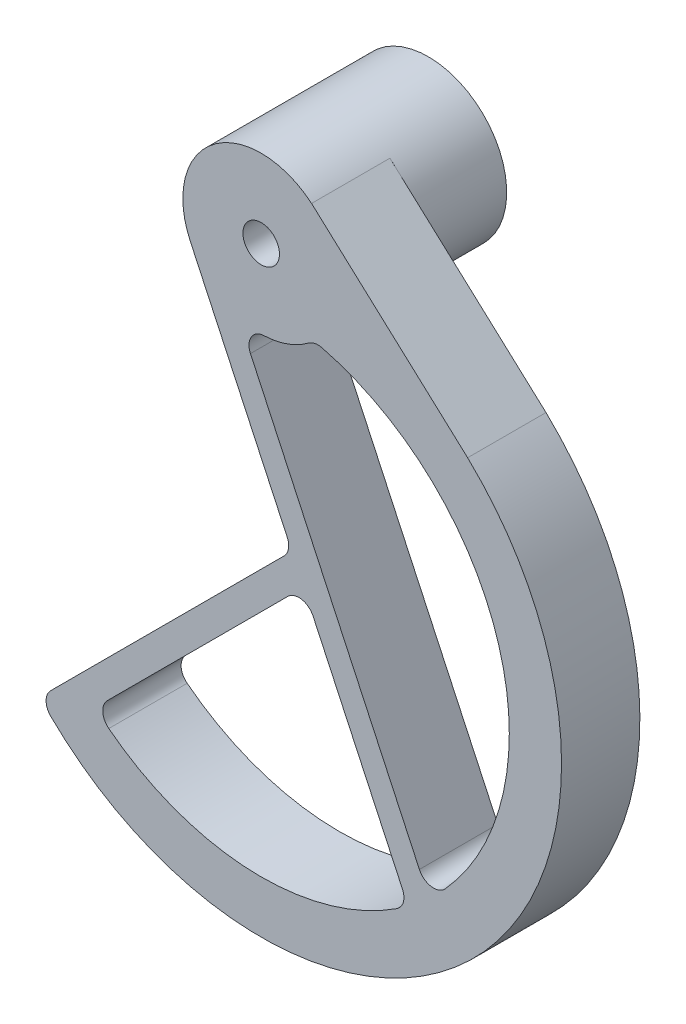
from build123d import *

# Parameters (mm, degrees)
EXTRUDE_1_DEPTH     = 15
SKETCH_6_R          = 3.5
CUT_EXTRUDE_2_DEPTH = 15
EXTRUDE_START       = 17
SKETCH_11_R         = 15
SKETCH_11_R_2       = 3.5
EXTRUDE_3_DEPTH     = 17
SKETCH_12_R         = 10.1
CUT_EXTRUDE_6_DEPTH = 2
SKETCH_13_R         = 0.5
CUT_EXTRUDE_7_DEPTH = 3


with BuildPart() as part:
    # ｽｹｯﾁ1 → ﾎﾞｽ - 押し出し1 (new body)
    with BuildSketch(Plane.XY):
        with BuildLine():
            Line((10.546944731, 68.165925034), (9.641814145, 68.990666647))
            ThreePointArc((9.641814145, 68.990666647), (-9.131421435, 69.400300104), (-13.594616806, 51.160726074))
            Line((-13.594616806, 51.160726074), (4.986432096, 11.313538113))
            ThreePointArc((4.986432096, 11.313538113), (5.221931994, 9.524738795), (4.388829079, 7.924362985))
            Line((4.388829079, 7.924362985), (-40.303464689, -36.767930783))
            ThreePointArc((-40.303464689, -36.767930783), (-41.182112782, -38.903012739), (-40.283913759, -41.029943849))
            ThreePointArc((-40.283913759, -41.029943849), (41.397896806, -39.905690573), (39.524106652, 41.762363359))
            Line((39.524106652, 41.762363359), (37.916838192, 43.226882625))
            Line((37.916838192, 43.226882625), (10.546944731, 68.165925034))
        make_face()
        with BuildLine():
            ThreePointArc((5.093338956, 1.55780505), (7.735603832, 2.390907965), (9.933582661, 0.704339492))
            Line((9.933582661, 0.704339492), (27.046217634, -35.993824637))
            ThreePointArc((27.046217634, -35.993824637), (27.212084573, -38.085077821), (25.967336583, -39.773702754))
            ThreePointArc((25.967336583, -39.773702754), (-1.972837213, -47.459012983), (-29.17877254, -37.481318454))
            ThreePointArc((-29.17877254, -37.481318454), (-30.330146685, -35.299826939), (-29.457223039, -32.992756945))
            Line((-29.457223039, -32.992756945), (5.093338956, 1.55780505))
        make_face(mode=Mode.SUBTRACT)
        with BuildLine():
            ThreePointArc((35.231836325, -31.858557864), (32.560090836, -32.813013733), (30.287744354, -31.114293205))
            Line((30.287744354, -31.114293205), (-2.054746852, 38.244403012))
            ThreePointArc((-2.054746852, 38.244403012), (-1.895310582, 41.077194163), (0.553480425, 42.510214831))
            ThreePointArc((0.553480425, 42.510214831), (5.039223996, 43.371793408), (9.057681155, 45.543478261))
            ThreePointArc((9.057681155, 45.543478261), (10.270904088, 46.091905397), (11.601973614, 46.061309233))
            ThreePointArc((11.601973614, 46.061309233), (45.455779175, 13.784851815), (35.231836325, -31.858557864))
        make_face(mode=Mode.SUBTRACT)
    extrude(amount=EXTRUDE_1_DEPTH)

    # ｽｹｯﾁ6 → ｶｯﾄ - 押し出し2 (cut)
    with BuildSketch(Plane.XY.offset(15)):
        with Locations((0, 57.5)):
            Circle(SKETCH_6_R)
    extrude(amount=-CUT_EXTRUDE_2_DEPTH, mode=Mode.SUBTRACT)

    # ｽｹｯﾁ11 → ﾎﾞｽ - 押し出し3 (add)
    with BuildSketch(Plane(origin=(0, 0, 0), x_dir=(-1, 0, 0), z_dir=(0, 0, -1)).offset(EXTRUDE_START)):
        with Locations((0, 57.5)):
            Circle(SKETCH_11_R)
        with Locations(Location((0, 57.5, 0), (0, 0, 180))):
            Circle(SKETCH_11_R_2, mode=Mode.SUBTRACT)
    extrude(amount=-EXTRUDE_3_DEPTH)

    # ｽｹｯﾁ12 → ｶｯﾄ - 押し出し6 (cut)
    with BuildSketch(Plane(origin=(0, 0, -17), x_dir=(-1, 0, 0), z_dir=(0, 0, -1))):
        with Locations((0, 57.5)):
            Circle(SKETCH_12_R)
    extrude(amount=-CUT_EXTRUDE_6_DEPTH, mode=Mode.SUBTRACT)

    # ｽｹｯﾁ13 → ｶｯﾄ - 押し出し7 (cut)
    with BuildSketch(Plane(origin=(0, 0, -15), x_dir=(-1, 0, 0), z_dir=(0, 0, -1))):
        with Locations((-3.5, 65.5)):
            Circle(SKETCH_13_R)
        with Locations((0, 65.5)):
            Circle(SKETCH_13_R)
        with Locations((3.5, 65.5)):
            Circle(SKETCH_13_R)
        with Locations((8, 57.5)):
            Circle(SKETCH_13_R)
        with Locations((8, 61)):
            Circle(SKETCH_13_R)
        with Locations((8, 54)):
            Circle(SKETCH_13_R)
        with Locations((0, 49.5)):
            Circle(SKETCH_13_R)
        with Locations((3.5, 49.5)):
            Circle(SKETCH_13_R)
        with Locations((-3.5, 49.5)):
            Circle(SKETCH_13_R)
        with Locations((-8, 57.5)):
            Circle(SKETCH_13_R)
        with Locations((-8, 54)):
            Circle(SKETCH_13_R)
        with Locations((-8, 61)):
            Circle(SKETCH_13_R)
    extrude(amount=-CUT_EXTRUDE_7_DEPTH, mode=Mode.SUBTRACT)


solid = part.part
